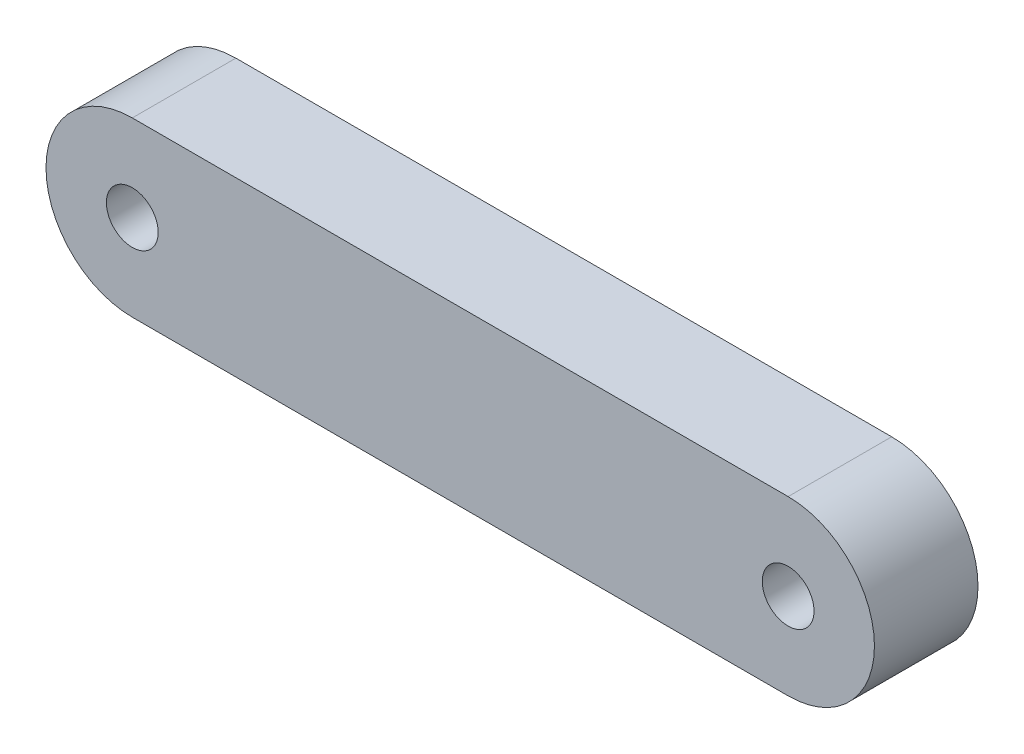
from build123d import *

# Parameters (mm, degrees)
SKETCH1_R        = 1.5
EXTRUSION1_DEPTH = 6


with BuildPart() as part:
    # Sketch1 → Extrusion1 (new body)
    with BuildSketch(Plane.XY):
        with BuildLine():
            Line((38, 5), (0, 5))
            ThreePointArc((0, 5), (-5, 0), (0, -5))
            Line((0, -5), (38, -5))
            ThreePointArc((38, -5), (43, 0), (38, 5))
        make_face()
        with Locations(Location((38, 0, 0), (0, 0, 180))):
            Circle(SKETCH1_R, mode=Mode.SUBTRACT)
        with Locations(Location((0, 0, 0), (0, 0, 180))):
            Circle(SKETCH1_R, mode=Mode.SUBTRACT)
    extrude(amount=EXTRUSION1_DEPTH)


solid = part.part
